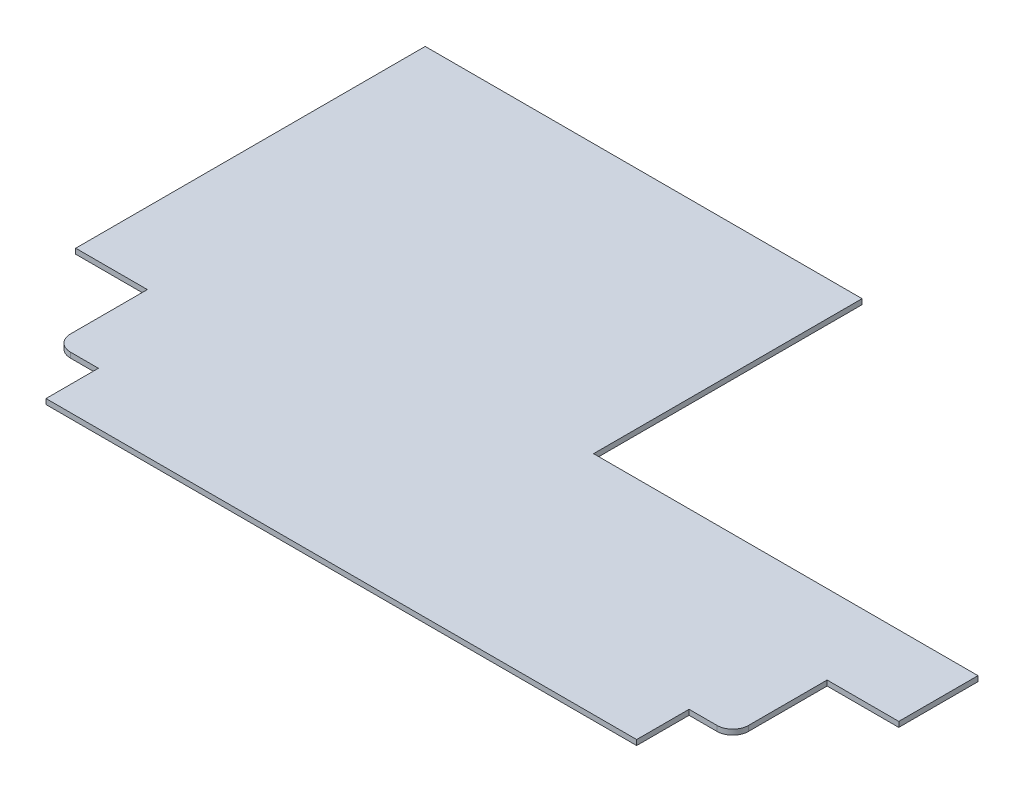
from build123d import *

# Parameters (mm, degrees)
CROQUIS1_W              = 250
CROQUIS1_H              = 250
SALIENTE_EXTRUIR1_DEPTH = 3
CROQUIS2_W              = 250
CROQUIS2_H              = 3
SALIENTE_EXTRUIR2_DEPTH = 3
CROQUIS3_W              = 220
CROQUIS3_H              = 99.34
SALIENTE_EXTRUIR4_DEPTH = 3
CROQUIS4_W              = 41
CROQUIS4_H              = 52
CORTAR_EXTRUIR1_DEPTH   = 3
CORTAR_EXTRUIR2_DEPTH   = 3
CROQUIS6_W              = 339
CROQUIS6_H              = 30
SALIENTE_EXTRUIR5_DEPTH = 3
CORTAR_EXTRUIR3_DEPTH   = 3
CROQUIS8_W              = 1
CROQUIS8_H              = 30
CORTAR_EXTRUIR4_DEPTH   = 10
CROQUIS10_W             = 41
CROQUIS10_H             = 1
CORTAR_EXTRUIR5_DEPTH   = 3


with BuildPart() as part:
    # Croquis1 → Saliente-Extruir1 (new body)
    with BuildSketch(Plane(origin=(0, 0, 0), x_dir=(1, 0, 0), z_dir=(0, 1, 0))):
        Rectangle(CROQUIS1_W, CROQUIS1_H)
    extrude(amount=SALIENTE_EXTRUIR1_DEPTH)

    # Croquis2 → Saliente-Extruir2 (add)
    with BuildSketch(Plane(origin=(0, 3, 0), x_dir=(1, 0, 0), z_dir=(0, 1, 0))):
        with Locations((0, 126.5)):
            Rectangle(CROQUIS2_W, CROQUIS2_H)
    extrude(amount=-SALIENTE_EXTRUIR2_DEPTH)

    # Croquis3 → Saliente-Extruir4 (add)
    with BuildSketch(Plane(origin=(0, 3, 0), x_dir=(1, 0, 0), z_dir=(0, 1, 0))):
        with Locations((235, -75.33)):
            Rectangle(CROQUIS3_W, CROQUIS3_H)
    extrude(amount=-SALIENTE_EXTRUIR4_DEPTH)

    # Croquis4 → Cortar-Extruir1 (cut)
    with BuildSketch(Plane(origin=(0, 3, 0), x_dir=(1, 0, 0), z_dir=(0, 1, 0))):
        with Locations((-104.5, -99)):
            Rectangle(CROQUIS4_W, CROQUIS4_H)
    extrude(amount=-CORTAR_EXTRUIR1_DEPTH, mode=Mode.SUBTRACT)

    # Croquis5 → Cortar-Extruir2 (cut)
    with BuildSketch(Plane(origin=(0, 3, 0), x_dir=(1, 0, 0), z_dir=(0, 1, 0))):
        with BuildLine():
            Line((-84, -116), (-84, -125))
            Line((-84, -125), (-75, -125))
            ThreePointArc((-75, -125), (-81.363961031, -122.363961031), (-84, -116))
        make_face()
    extrude(amount=-CORTAR_EXTRUIR2_DEPTH, mode=Mode.SUBTRACT)

    # Croquis6 → Saliente-Extruir5 (add)
    with BuildSketch(Plane(origin=(0, 3, 0), x_dir=(1, 0, 0), z_dir=(0, 1, 0))):
        with Locations((110.5, -140)):
            Rectangle(CROQUIS6_W, CROQUIS6_H)
    extrude(amount=-SALIENTE_EXTRUIR5_DEPTH)

    # Croquis7 → Cortar-Extruir3 (cut)
    with BuildSketch(Plane(origin=(0, 3, 0), x_dir=(1, 0, 0), z_dir=(0, 1, 0))):
        with BuildLine():
            Line((345, -72), (304, -72))
            Line((304, -72), (304, -116))
            ThreePointArc((304, -116), (301.363961031, -122.363961031), (295, -125))
            Line((295, -125), (345, -125))
            Line((345, -125), (345, -72))
        make_face()
    extrude(amount=-CORTAR_EXTRUIR3_DEPTH, mode=Mode.SUBTRACT)

    # Croquis8 → Cortar-Extruir4 (cut)
    with BuildSketch(Plane(origin=(0, 3, 0), x_dir=(1, 0, 0), z_dir=(0, 1, 0))):
        with Locations((279.5, -140)):
            Rectangle(CROQUIS8_W, CROQUIS8_H)
    extrude(amount=-CORTAR_EXTRUIR4_DEPTH, mode=Mode.SUBTRACT)

    # Croquis10 → Cortar-Extruir5 (cut)
    with BuildSketch(Plane(origin=(0, 3, 0), x_dir=(1, 0, 0), z_dir=(0, 1, 0))):
        with Locations((-104.5, -72.5)):
            Rectangle(CROQUIS10_W, CROQUIS10_H)
        with Locations((324.5, -71.5)):
            Rectangle(CROQUIS10_W, CROQUIS10_H)
    extrude(amount=-CORTAR_EXTRUIR5_DEPTH, mode=Mode.SUBTRACT)


solid = part.part
